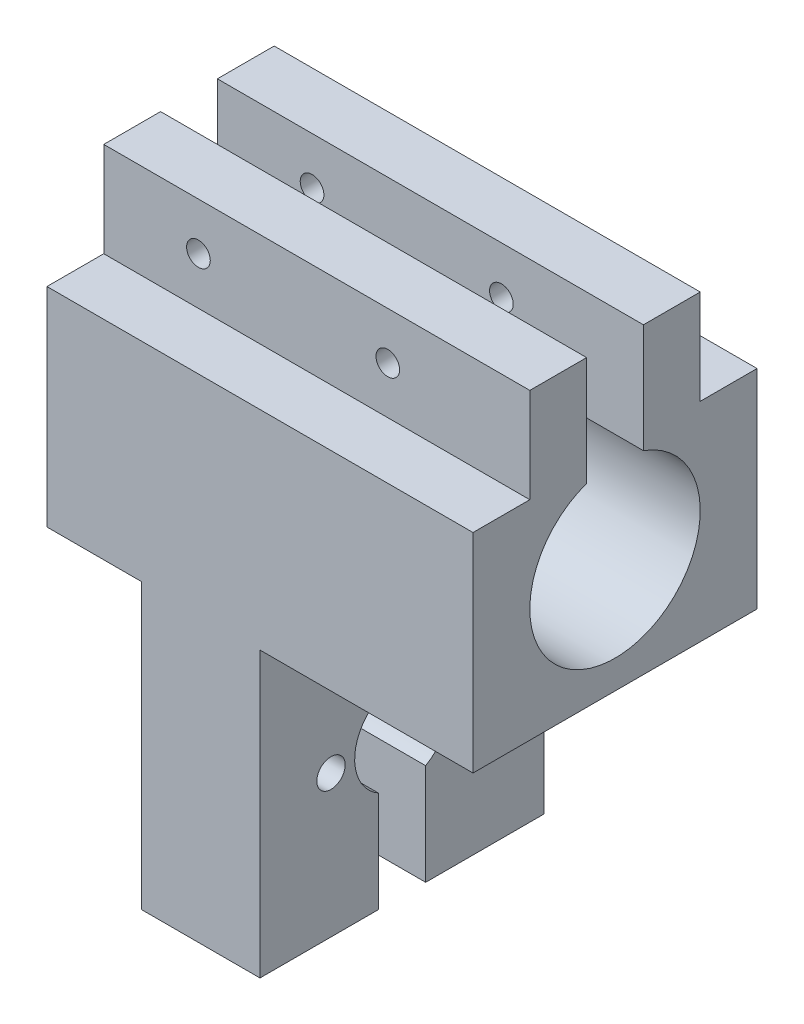
from build123d import *

# Parameters (mm, degrees)
SKETCH1_R           = 5
BOSS_EXTRUDE1_DEPTH = 22.5
SKETCH3_W           = 10
SKETCH3_H           = 30
CUT_EXTRUDE1_DEPTH  = 45
SKETCH4_R           = 1.5
CUT_EXTRUDE2_DEPTH  = 45
SKETCH4_3_R         = 1.5
CUT_EXTRUDE3_DEPTH  = 45
SKETCH6_W           = 10
SKETCH6_H           = 30
CUT_EXTRUDE4_DEPTH  = 45
SKETCH7_W           = 12.5
SKETCH7_H           = 30
CUT_EXTRUDE5_DEPTH  = 45
SKETCH8_W           = 5
SKETCH8_H           = 10.669872981
CUT_EXTRUDE6_DEPTH  = 45
SKETCH9_R           = 1.25
CUT_EXTRUDE7_DEPTH  = 150


with BuildPart() as part:
    # Sketch1 → Boss-Extrude1 (new, symmetric)
    with BuildSketch(Plane(origin=(0, 0, 0), x_dir=(0, 0, -1), z_dir=(1, 0, 0))):
        with BuildLine():
            Line((-24, 50), (-24, 40))
            Line((-24, 40), (-30, 40))
            Line((-30, 40), (-30, 0))
            Line((-30, 0), (-30, -12))
            Line((-30, -12), (0, -12))
            Line((0, -12), (0, 0))
            Line((0, 0), (0, 40))
            Line((0, 40), (-6, 40))
            Line((-6, 40), (-6, 50))
            Line((-6, 50), (-12, 50))
            Line((-12, 50), (-12, 38.485281374))
            ThreePointArc((-12, 38.485281374), (-15, 21), (-18, 38.485281374))
            Line((-18, 38.485281374), (-18, 50))
            Line((-18, 50), (-24, 50))
        make_face()
        with Locations((-15, 3)):
            Circle(SKETCH1_R, mode=Mode.SUBTRACT)
    extrude(amount=BOSS_EXTRUDE1_DEPTH, both=True)

    # Sketch3 → Cut-Extrude1 (cut)
    with BuildSketch(Plane(origin=(0, 0, 0), x_dir=(-1, 0, 0), z_dir=(0, 0, -1))):
        with Locations((17.5, 3)):
            Rectangle(SKETCH3_W, SKETCH3_H)
    extrude(amount=-CUT_EXTRUDE1_DEPTH, mode=Mode.SUBTRACT)

    # Sketch4 → Cut-Extrude2 (cut)
    with BuildSketch(Plane.ZY.offset(12.5)):
        with Locations((22.5, 3)):
            Circle(SKETCH4_R)
    extrude(amount=-CUT_EXTRUDE2_DEPTH, mode=Mode.SUBTRACT)

    # Sketch4<3> → Cut-Extrude3 (cut)
    with BuildSketch(Plane.ZY.offset(12.5)):
        with Locations((7.5, 3)):
            Circle(SKETCH4_3_R)
    extrude(amount=-CUT_EXTRUDE3_DEPTH, mode=Mode.SUBTRACT)

    # Sketch6 → Cut-Extrude4 (cut)
    with BuildSketch(Plane(origin=(0, 0, 0), x_dir=(-1, 0, 0), z_dir=(0, 0, -1))):
        with Locations((-5, 3)):
            Rectangle(SKETCH6_W, SKETCH6_H)
    extrude(amount=-CUT_EXTRUDE4_DEPTH, mode=Mode.SUBTRACT)

    # Sketch7 → Cut-Extrude5 (cut)
    with BuildSketch(Plane(origin=(0, 0, 0), x_dir=(-1, 0, 0), z_dir=(0, 0, -1))):
        with Locations((-16.25, 3)):
            Rectangle(SKETCH7_W, SKETCH7_H)
    extrude(amount=-CUT_EXTRUDE5_DEPTH, mode=Mode.SUBTRACT)

    # Sketch8 → Cut-Extrude6 (cut)
    with BuildSketch(Plane(origin=(0, 0, 0), x_dir=(0, 0, -1), z_dir=(1, 0, 0))):
        with Locations((-15, -6.66506351)):
            Rectangle(SKETCH8_W, SKETCH8_H)
    extrude(amount=-CUT_EXTRUDE6_DEPTH, mode=Mode.SUBTRACT)

    # Sketch9 → Cut-Extrude7 (cut)
    with BuildSketch(Plane(origin=(0, 0, 6), x_dir=(-1, 0, 0), z_dir=(0, 0, -1))):
        with Locations((12.5, 45)):
            Circle(SKETCH9_R)
        with Locations((-7.5, 45)):
            Circle(SKETCH9_R)
    extrude(amount=-CUT_EXTRUDE7_DEPTH, mode=Mode.SUBTRACT)


solid = part.part
